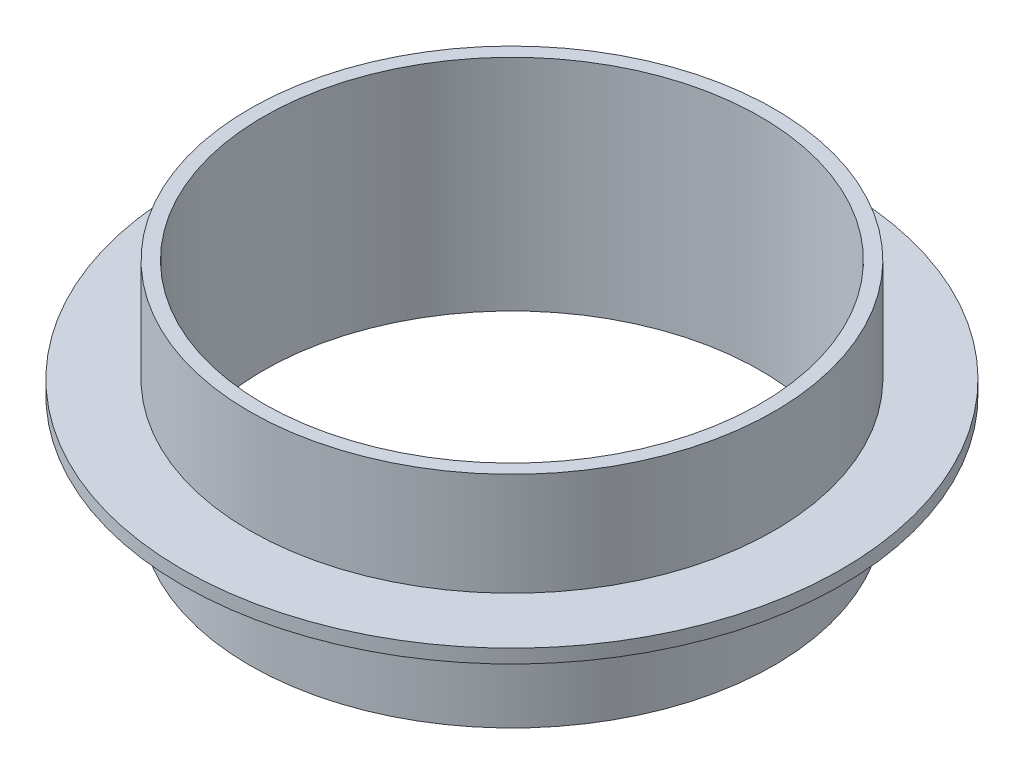
from build123d import *

# Parameters (mm, degrees)
SKETCH1_R                   = 60.6425
SKETCH1_R_2                 = 57.4675
BOSS_EXTRUDE1_DEPTH         = 50.8
BOSS_EXTRUDE2_START         = -26.9875
SKETCH2_R                   = 76.2
SKETCH2_R_2                 = 60.6425
BOSS_EXTRUDE2_DEPTH         = 3.175
F_1_4_CLEARANCE_HOLE1_D     = 6.5278
F_1_4_CLEARANCE_HOLE1_DEPTH = 38.354
F_1_4_CLEARANCE_HOLE1_TIP   = 1.961148974


with BuildPart() as part:
    # Sketch1 → Boss-Extrude1 (new body)
    with BuildSketch(Plane(origin=(0, 0, 0), x_dir=(1, 0, 0), z_dir=(0, 1, 0))):
        with Locations(Location((0, 0, 0), (0, 0, 270))):
            Circle(SKETCH1_R)
        with Locations(Location((0, 0, 0), (0, 0, 270))):
            Circle(SKETCH1_R_2, mode=Mode.SUBTRACT)
    extrude(amount=BOSS_EXTRUDE1_DEPTH)

    # Sketch2 → Boss-Extrude2 (add)
    with BuildSketch(Plane(origin=(0, 50.8, 0), x_dir=(1, 0, 0), z_dir=(0, 1, 0)).offset(BOSS_EXTRUDE2_START)):
        with Locations(Location((0, 0, 0), (0, 0, 270))):
            Circle(SKETCH2_R)
        with Locations(Location((0, 0, 0), (0, 0, 270))):
            Circle(SKETCH2_R_2, mode=Mode.SUBTRACT)
    extrude(amount=BOSS_EXTRUDE2_DEPTH)

    # 1/4 Clearance Hole1
    with Locations(Plane(origin=(0, 26.9875, 0), x_dir=(1, 0, 0), z_dir=(0, 1, 0))):
        with Locations((-68.42125, 0)):
            Hole(F_1_4_CLEARANCE_HOLE1_D / 2, depth=F_1_4_CLEARANCE_HOLE1_DEPTH)
            with Locations((0, 0, -(F_1_4_CLEARANCE_HOLE1_DEPTH + F_1_4_CLEARANCE_HOLE1_TIP / 2))):  # 118° drill point
                Cone(0, F_1_4_CLEARANCE_HOLE1_D / 2, F_1_4_CLEARANCE_HOLE1_TIP, mode=Mode.SUBTRACT)


solid = part.part
